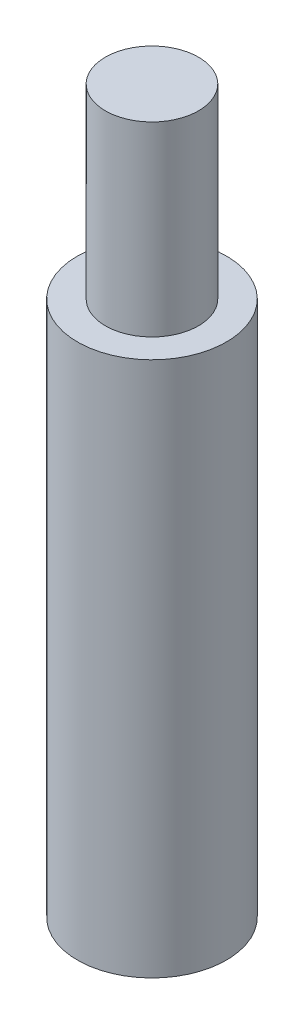
from build123d import *


with BuildPart() as part:
    # Sketch2 → Revolve1 (revolve)
    with BuildSketch(Plane.XY, mode=Mode.PRIVATE) as revolve1_sk:
        Polygon((0, 0), (1, 0), (1, -4), (1.6, -4), (1.6, -15.5), (1.05, -15.5), (1.05, -11.5), (0, -11.5), align=None)
    revolve(revolve1_sk.sketch.rotate(Axis((0, 0, 0), (0, -1, 0)), 180), axis=Axis((0, 0, 0), (0, -1, 0)))


solid = part.part
